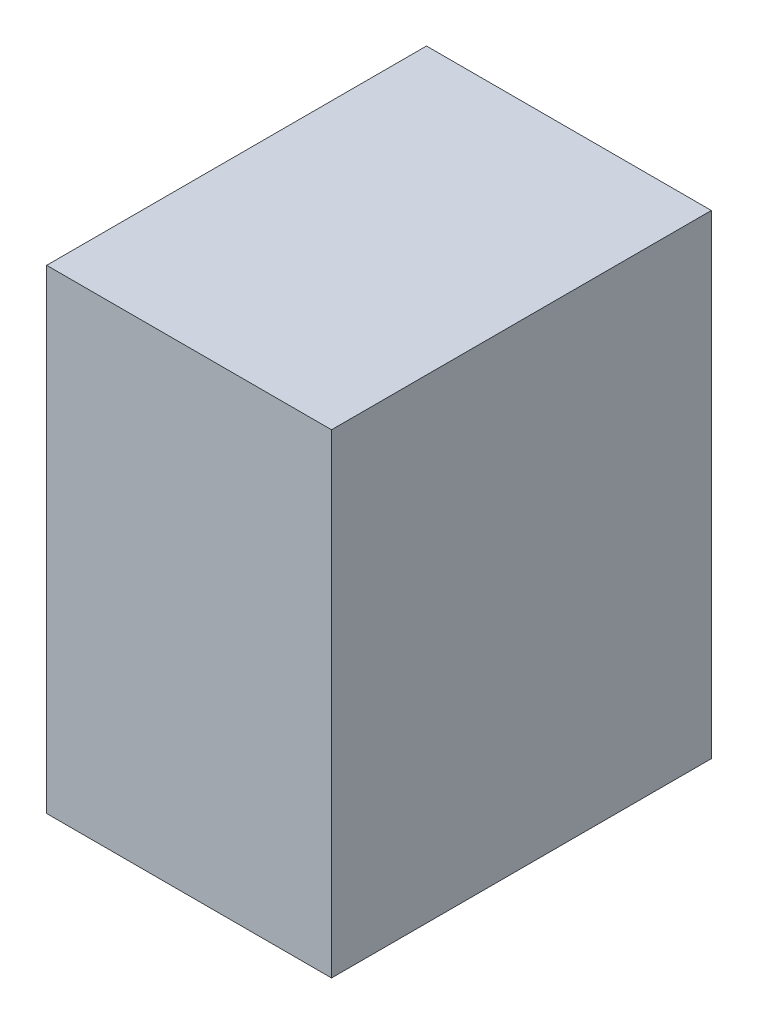
from build123d import *

# Parameters (mm, degrees)
SKETCH_1_W          = 3
SKETCH_1_H          = 4
EXTRUDE_1_DEPTH     = 5
SKETCH_2_W          = 1
SKETCH_2_H          = 1.75
CUT_EXTRUDE_1_DEPTH = 4


with BuildPart() as part:
    # 草图1 → 凸台-拉伸1 (new body)
    with BuildSketch(Plane(origin=(0, 0, 0), x_dir=(1, 0, 0), z_dir=(0, 1, 0))):
        with Locations((-59.159150363, -8.326063526)):
            Rectangle(SKETCH_1_W, SKETCH_1_H)
    extrude(amount=EXTRUDE_1_DEPTH)

    # 草图2 → 切除-拉伸1 (cut)
    with BuildSketch(Plane.XZ):
        with Locations((-58.659150363, 9.201063526)):
            Rectangle(SKETCH_2_W, SKETCH_2_H)
        with Locations((-58.659150363, 7.451063526)):
            Rectangle(SKETCH_2_W, SKETCH_2_H)
        with Locations((-59.659150363, 7.451063526)):
            Rectangle(SKETCH_2_W, SKETCH_2_H)
        with Locations((-59.659150363, 9.201063526)):
            Rectangle(SKETCH_2_W, SKETCH_2_H)
    extrude(amount=-CUT_EXTRUDE_1_DEPTH, mode=Mode.SUBTRACT)


solid = part.part
